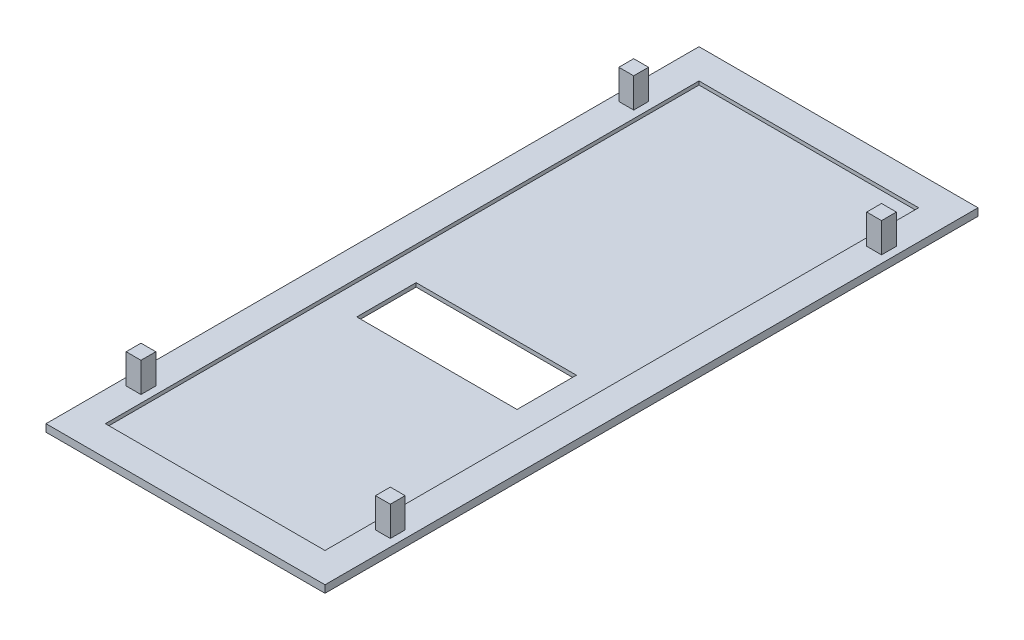
from build123d import *

# Parameters (mm, degrees)
SKETCH1_W           = 47
SKETCH1_H           = 110
BOSS_EXTRUDE1_DEPTH = 1.25
SKETCH2_W           = 2.5
SKETCH2_H           = 2.5
BOSS_EXTRUDE2_DEPTH = 5
SKETCH3_W           = 27
SKETCH3_H           = 10
CUT_EXTRUDE1_DEPTH  = 5
SKETCH6_W           = 37
SKETCH6_H           = 100
CUT_EXTRUDE2_DEPTH  = 0.6


with BuildPart() as part:
    # Sketch1 → Boss-Extrude1 (new body)
    with BuildSketch(Plane(origin=(0, 0, 0), x_dir=(1, 0, 0), z_dir=(0, 1, 0))):
        with Locations((23.5, 55)):
            Rectangle(SKETCH1_W, SKETCH1_H)
    extrude(amount=BOSS_EXTRUDE1_DEPTH)

    # Sketch2 → Boss-Extrude2 (add)
    with BuildSketch(Plane(origin=(0, 1.25, 0), x_dir=(1, 0, 0), z_dir=(0, 1, 0))):
        with Locations((44.5, 96.25)):
            Rectangle(SKETCH2_W, SKETCH2_H)
        with Locations((44.5, 13.5)):
            Rectangle(SKETCH2_W, SKETCH2_H)
        with Locations((2.5, 13.5)):
            Rectangle(SKETCH2_W, SKETCH2_H)
        with Locations((2.5, 96.5)):
            Rectangle(SKETCH2_W, SKETCH2_H)
    extrude(amount=BOSS_EXTRUDE2_DEPTH)

    # Sketch3 → Cut-Extrude1 (cut)
    with BuildSketch(Plane(origin=(0, 1.25, 0), x_dir=(1, 0, 0), z_dir=(0, 1, 0))):
        with Locations((23.5, 47.35)):
            Rectangle(SKETCH3_W, SKETCH3_H)
    extrude(amount=-CUT_EXTRUDE1_DEPTH, mode=Mode.SUBTRACT)

    # Sketch6 → Cut-Extrude2 (cut)
    with BuildSketch(Plane(origin=(0, 1.25, 0), x_dir=(1, 0, 0), z_dir=(0, 1, 0))):
        with Locations((23.5, 55)):
            Rectangle(SKETCH6_W, SKETCH6_H)
    extrude(amount=-CUT_EXTRUDE2_DEPTH, mode=Mode.SUBTRACT)


solid = part.part
